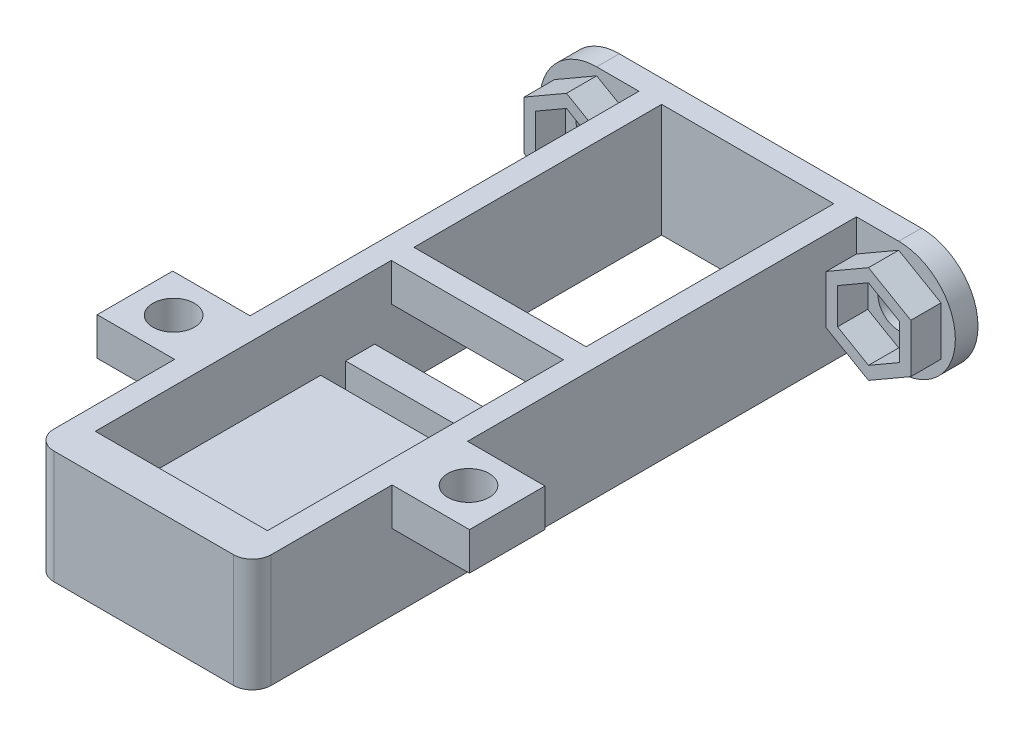
from build123d import *

# Parameters (mm, degrees)
SKETCH2_R           = 7.5
SKETCH2_R_2         = 2.75
BOSS_EXTRUDE1_DEPTH = 3
SKETCH3_R           = 5.6
BOSS_EXTRUDE2_DEPTH = 4
BOSS_EXTRUDE3_DEPTH = 80
SKETCH5_W           = 29.85
SKETCH5_H           = 6.5
SKETCH5_W_2         = 3.85
BOSS_EXTRUDE4_DEPTH = 80
SKETCH6_W           = 29.85
SKETCH6_H           = 6.5
SKETCH6_W_2         = 3.85
CUT_EXTRUDE1_DEPTH  = 54.2
BOSS_EXTRUDE5_DEPTH = 22.8
SKETCH8_W           = 10.25
SKETCH8_H           = 10
SKETCH8_R           = 2.75
BOSS_EXTRUDE6_DEPTH = 5
BOSS_EXTRUDE7_DEPTH = 5
FILLET1_R           = 2.5


with BuildPart() as part:
    # Sketch2 → Boss-Extrude1 (new body)
    # profile 1 of 4: a face of its own
    with BuildSketch(Plane.XY):
        with Locations((-20, -30)):
            Circle(SKETCH2_R)
        with Locations((-20, -30)):
            Circle(SKETCH2_R_2, mode=Mode.SUBTRACT)
    # profile 2 of 4: a face of its own
    with BuildSketch(Plane.XY):
        with BuildLine():
            Line((12.5, -22.5), (-20, -22.5))
            ThreePointArc((-20, -22.5), (-14.696699141, -24.696699141), (-12.5, -30))
            ThreePointArc((-12.5, -30), (-14.696699141, -35.303300859), (-20, -37.5))
            Line((-20, -37.5), (20, -37.5))
            ThreePointArc((20, -37.5), (14.696699141, -35.303300859), (12.5, -30))
            Line((12.5, -30), (12.5, -22.5))
        make_face()
    # profile 3 of 4: a face of its own
    with BuildSketch(Plane.XY):
        with Locations((20, -30)):
            Circle(SKETCH2_R)
        with Locations((20, -30)):
            Circle(SKETCH2_R_2, mode=Mode.SUBTRACT)
    # profile 4 of 4: a face of its own
    with BuildSketch(Plane.XY):
        with BuildLine():
            Line((20, -22.5), (12.5, -22.5))
            Line((12.5, -22.5), (12.5, -30))
            ThreePointArc((12.5, -30), (14.696699141, -24.696699141), (20, -22.5))
        make_face()
    extrude(amount=BOSS_EXTRUDE1_DEPTH)

    # Sketch3 → Boss-Extrude2 (add)
    # profile 1 of 14: a face of its own
    with BuildSketch(Plane.XY.offset(3)):
        with BuildLine():
            Line((-14.4, -26.766838493), (-17.199999967, -25.150257758))
            ThreePointArc((-17.199999967, -25.150257758), (-15.150257729, -27.200000016), (-14.4, -30))
            Line((-14.4, -30), (-14.4, -26.766838493))
        make_face()
    # profile 2 of 14: a face of its own
    with BuildSketch(Plane.XY.offset(3)):
        with Locations((-20, -30)):
            Circle(SKETCH3_R)
        Polygon((-15.9, -27.632863896), (-20, -25.265727793), (-24.1, -27.632863896), (-24.1, -32.367136104), (-20, -34.734272207), (-15.9, -32.367136104), align=None, mode=Mode.SUBTRACT)
    # profile 3 of 14: a face of its own
    with BuildSketch(Plane.XY.offset(3)):
        with BuildLine():
            Line((-17.199999967, -25.150257758), (-20, -23.533676985))
            Line((-20, -23.533676985), (-22.800000033, -25.150257758))
            ThreePointArc((-22.800000033, -25.150257758), (-20, -24.4), (-17.199999967, -25.150257758))
        make_face()
    # profile 4 of 14: a face of its own
    with BuildSketch(Plane.XY.offset(3)):
        with BuildLine():
            ThreePointArc((-25.6, -30), (-24.849742271, -27.200000016), (-22.800000033, -25.150257758))
            Line((-22.800000033, -25.150257758), (-25.6, -26.766838493))
            Line((-25.6, -26.766838493), (-25.6, -30))
        make_face()
    # profile 5 of 14: a face of its own
    with BuildSketch(Plane.XY.offset(3)):
        with BuildLine():
            ThreePointArc((-22.800000033, -34.849742242), (-24.849742271, -32.799999984), (-25.6, -30))
            Line((-25.6, -30), (-25.6, -33.233161507))
            Line((-25.6, -33.233161507), (-22.800000033, -34.849742242))
        make_face()
    # profile 6 of 14: a face of its own
    with BuildSketch(Plane.XY.offset(3)):
        with BuildLine():
            ThreePointArc((-17.199999967, -34.849742242), (-20, -35.6), (-22.800000033, -34.849742242))
            Line((-22.800000033, -34.849742242), (-20, -36.466323015))
            Line((-20, -36.466323015), (-17.199999967, -34.849742242))
        make_face()
    # profile 7 of 14: a face of its own
    with BuildSketch(Plane.XY.offset(3)):
        with BuildLine():
            Line((-14.4, -33.233161507), (-14.4, -30))
            ThreePointArc((-14.4, -30), (-15.150257729, -32.799999984), (-17.199999967, -34.849742242))
            Line((-17.199999967, -34.849742242), (-14.4, -33.233161507))
        make_face()
    # profile 8 of 14: a face of its own
    with BuildSketch(Plane.XY.offset(3)):
        with BuildLine():
            Line((25.6, -26.766838493), (22.800000033, -25.150257758))
            ThreePointArc((22.800000033, -25.150257758), (24.849742271, -27.200000016), (25.6, -30))
            Line((25.6, -30), (25.6, -26.766838493))
        make_face()
    # profile 9 of 14: a face of its own
    with BuildSketch(Plane.XY.offset(3)):
        with Locations((20, -30)):
            Circle(SKETCH3_R)
        Polygon((24.1, -27.632863896), (20, -25.265727793), (15.9, -27.632863896), (15.9, -32.367136104), (20, -34.734272207), (24.1, -32.367136104), align=None, mode=Mode.SUBTRACT)
    # profile 10 of 14: a face of its own
    with BuildSketch(Plane.XY.offset(3)):
        with BuildLine():
            Line((22.800000033, -25.150257758), (20, -23.533676985))
            Line((20, -23.533676985), (17.199999967, -25.150257758))
            ThreePointArc((17.199999967, -25.150257758), (20, -24.4), (22.800000033, -25.150257758))
        make_face()
    # profile 11 of 14: a face of its own
    with BuildSketch(Plane.XY.offset(3)):
        with BuildLine():
            ThreePointArc((14.4, -30), (15.150257729, -27.200000016), (17.199999967, -25.150257758))
            Line((17.199999967, -25.150257758), (14.4, -26.766838493))
            Line((14.4, -26.766838493), (14.4, -30))
        make_face()
    # profile 12 of 14: a face of its own
    with BuildSketch(Plane.XY.offset(3)):
        with BuildLine():
            ThreePointArc((17.199999967, -34.849742242), (15.150257729, -32.799999984), (14.4, -30))
            Line((14.4, -30), (14.4, -33.233161507))
            Line((14.4, -33.233161507), (17.199999967, -34.849742242))
        make_face()
    # profile 13 of 14: a face of its own
    with BuildSketch(Plane.XY.offset(3)):
        with BuildLine():
            ThreePointArc((22.799999796, -34.849742379), (19.999999863, -35.6), (17.199999967, -34.849742242))
            Line((17.199999967, -34.849742242), (20, -36.466323015))
            Line((20, -36.466323015), (22.799999796, -34.849742379))
        make_face()
    # profile 14 of 14: a face of its own
    with BuildSketch(Plane.XY.offset(3)):
        with BuildLine():
            Line((25.6, -33.233161507), (25.6, -30))
            ThreePointArc((25.6, -30), (24.849742202, -32.800000102), (22.799999796, -34.849742379))
            Line((22.799999796, -34.849742379), (25.6, -33.233161507))
        make_face()
    extrude(amount=BOSS_EXTRUDE2_DEPTH)

    # Sketch4 → Boss-Extrude3 (add)
    with BuildSketch(Plane.XY.offset(3)):
        Polygon((-14.4, -26.766838493), (-14.4, -22.5), (-11.4, -22.5), (-11.4, -37.5), (-14.4, -37.5), align=None)
        Polygon((14.4, -30), (14.4, -22.5), (11.4, -22.5), (11.4, -37.5), (14.4, -37.5), align=None)
    extrude(amount=BOSS_EXTRUDE3_DEPTH)

    # Sketch5 → Boss-Extrude4 (add)
    with BuildSketch(Plane.ZY.offset(-11.4)):
        with Locations((63.075, -34.25)):
            Rectangle(SKETCH5_W, SKETCH5_H)
        with Locations((42.925, -34.25)):
            Rectangle(SKETCH5_W_2, SKETCH5_H)
    extrude(amount=BOSS_EXTRUDE4_DEPTH)

    # Sketch6 → Cut-Extrude1 (cut)
    with BuildSketch(Plane.ZY.offset(68.6)):
        with Locations((63.075, -34.25)):
            Rectangle(SKETCH6_W, SKETCH6_H)
        with Locations((42.925, -34.25)):
            Rectangle(SKETCH6_W_2, SKETCH6_H)
    extrude(amount=-CUT_EXTRUDE1_DEPTH, mode=Mode.SUBTRACT)

    # Sketch7 → Boss-Extrude5 (add)
    with BuildSketch(Plane.ZY.offset(-11.4)):
        Polygon((78, -31), (78, -22.5), (83, -22.5), (83, -37.5), (78, -37.5), align=None)
    extrude(amount=BOSS_EXTRUDE5_DEPTH)

    # Sketch8 → Boss-Extrude6 (add)
    # profile 1 of 2: a face of its own
    with BuildSketch(Plane.XZ.offset(22.5)):
        with Locations((-19.525, 59.5)):
            Rectangle(SKETCH8_W, SKETCH8_H)
        with Locations((-19.525, 59.5)):
            Circle(SKETCH8_R, mode=Mode.SUBTRACT)
    # profile 2 of 2: a face of its own
    with BuildSketch(Plane.XZ.offset(22.5)):
        with Locations((19.525, 59.5)):
            Rectangle(SKETCH8_W, SKETCH8_H)
        with Locations((19.525, 59.5)):
            Circle(SKETCH8_R, mode=Mode.SUBTRACT)
    extrude(amount=BOSS_EXTRUDE6_DEPTH)

    # Sketch10 → Boss-Extrude7 (add)
    with BuildSketch(Plane(origin=(0, -22.5, 0), x_dir=(1, 0, 0), z_dir=(0, 1, 0))):
        Polygon((-10, -38.8), (10, -38.8), (11.4, -38.8), (11.4, -35.8), (-11.4, -35.8), (-11.4, -38.8), align=None)
    extrude(amount=-BOSS_EXTRUDE7_DEPTH)

    # Fillet1
    fillet1_edges = [part.edges().sort_by_distance(p)[0] for p in [
        (-14.4, -30, 83),
        (14.4, -30, 83),
    ]]
    fillet(fillet1_edges, radius=FILLET1_R)


solid = part.part
